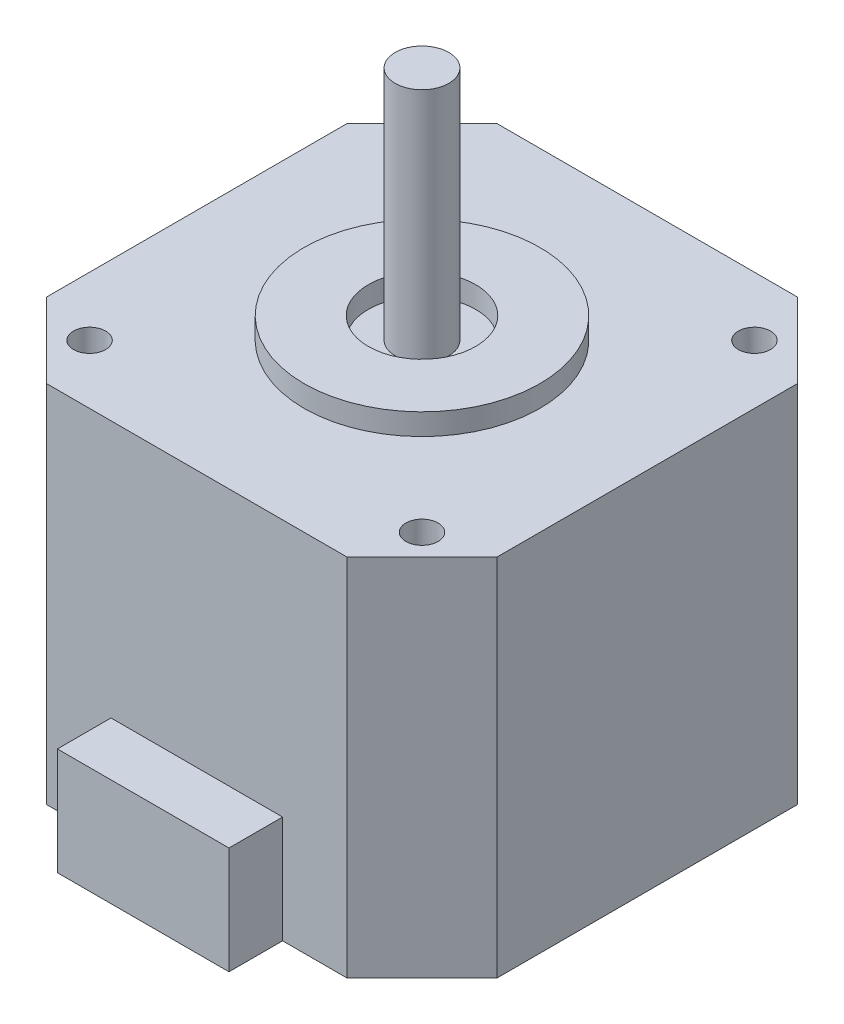
from build123d import *

# Parameters (mm, degrees)
BOSS_EXTRUDE1_DEPTH = 34
SKETCH2_W           = 16
SKETCH2_H           = 10
BOSS_EXTRUDE2_DEPTH = 5
SKETCH3_R           = 11
SKETCH3_R_2         = 5
BOSS_EXTRUDE3_DEPTH = 2
SKETCH4_R           = 2.5
BOSS_EXTRUDE4_DEPTH = 22
SKETCH5_R           = 1.5
CUT_EXTRUDE1_DEPTH  = 22


with BuildPart() as part:
    # Sketch1 → Boss-Extrude1 (new body)
    with BuildSketch(Plane(origin=(0, 0, 0), x_dir=(1, 0, 0), z_dir=(0, 1, 0))):
        Polygon((7, 42), (0, 35), (0, 7), (7, 0), (35, 0), (42, 7), (42, 35), (35, 42), align=None)
    extrude(amount=BOSS_EXTRUDE1_DEPTH)

    # Sketch2 → Boss-Extrude2 (add)
    with BuildSketch(Plane.XY):
        with Locations((21, 5)):
            Rectangle(SKETCH2_W, SKETCH2_H)
    extrude(amount=BOSS_EXTRUDE2_DEPTH)

    # Sketch3 → Boss-Extrude3 (add)
    with BuildSketch(Plane(origin=(0, 34, 0), x_dir=(1, 0, 0), z_dir=(0, 1, 0))):
        with Locations(Location((21, 21, 0), (0, 0, 270))):
            Circle(SKETCH3_R)
        with Locations(Location((21, 21, 0), (0, 0, 270))):
            Circle(SKETCH3_R_2, mode=Mode.SUBTRACT)
    extrude(amount=BOSS_EXTRUDE3_DEPTH)

    # Sketch4 → Boss-Extrude4 (add)
    with BuildSketch(Plane(origin=(0, 34, 0), x_dir=(1, 0, 0), z_dir=(0, 1, 0))):
        with Locations(Location((21, 21, 0), (0, 0, 270))):
            Circle(SKETCH4_R)
    extrude(amount=BOSS_EXTRUDE4_DEPTH)

    # Sketch5 → Cut-Extrude1 (cut)
    with BuildSketch(Plane(origin=(0, 34, 0), x_dir=(1, 0, 0), z_dir=(0, 1, 0))):
        with Locations(Location((5.5, 36.5, 0), (0, 0, 270))):
            Circle(SKETCH5_R)
        with Locations(Location((5.5, 5.5, 0), (0, 0, 270))):
            Circle(SKETCH5_R)
        with Locations(Location((36.5, 5.5, 0), (0, 0, 270))):
            Circle(SKETCH5_R)
        with Locations(Location((36.5, 36.5, 0), (0, 0, 270))):
            Circle(SKETCH5_R)
    extrude(amount=-CUT_EXTRUDE1_DEPTH, mode=Mode.SUBTRACT)


solid = part.part
